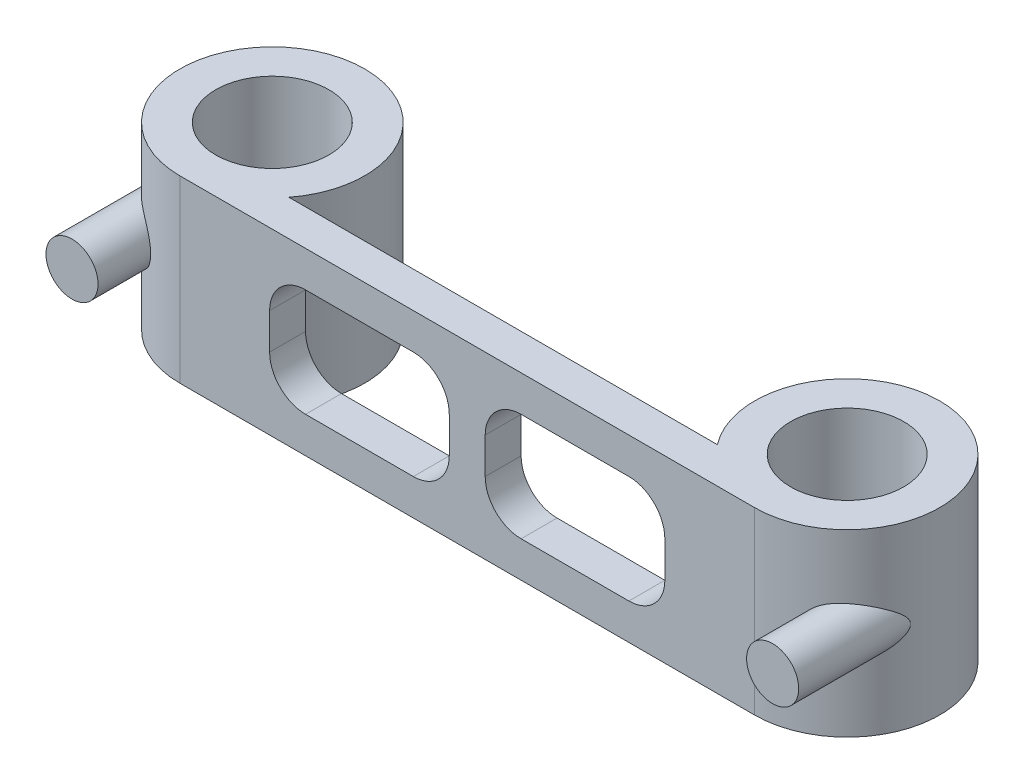
from build123d import *

# Parameters (mm, degrees)
SKETCH1_R           = 3.15
BOSS_EXTRUDE1_DEPTH = 10
BOSS_EXTRUDE2_REACH = 27.562
SKETCH2_R           = 1.45
BOSS_EXTRUDE3_START = 2.5
SKETCH3_R           = 1.45
BOSS_EXTRUDE3_DEPTH = 2.5
CUT_EXTRUDE1_REACH  = 27.562
SKETCH4_W           = 10
SKETCH4_H           = 6
FILLET1_R           = 2


with BuildPart() as part:
    # Sketch1 → Boss-Extrude1 (new body)
    with BuildSketch(Plane(origin=(0, 0, 0), x_dir=(1, 0, 0), z_dir=(0, 1, 0))):
        with BuildLine():
            Line((11.925690243, -3.15), (-11.925690243, -3.15))
            ThreePointArc((-11.925690243, -3.15), (-18.269361144, 4.623040125), (-16, -5.15))
            Line((-16, -5.15), (16, -5.15))
            ThreePointArc((16, -5.15), (18.269361144, 4.623040125), (11.925690243, -3.15))
        make_face()
        with Locations((-16, 0)):
            Circle(SKETCH1_R, mode=Mode.SUBTRACT)
        with Locations((16, 0)):
            Circle(SKETCH1_R, mode=Mode.SUBTRACT)
    extrude(amount=BOSS_EXTRUDE1_DEPTH)

    # Sketch2 → Boss-Extrude2 (add, up to next)
    with BuildSketch(Plane.XY.offset(5.15), mode=Mode.PRIVATE) as boss_extrude2_sk1:
        with Locations((-19.5, 5)):
            Circle(SKETCH2_R)
    boss_extrude2_tool1 = extrude(boss_extrude2_sk1.sketch, amount=-BOSS_EXTRUDE2_REACH, mode=Mode.PRIVATE) - part.part
    # Sketch2 → Boss-Extrude2 (add, up to next)
    with BuildSketch(Plane.XY.offset(5.15), mode=Mode.PRIVATE) as boss_extrude2_sk2:
        with Locations((19.5, 5)):
            Circle(SKETCH2_R)
    boss_extrude2_tool2 = extrude(boss_extrude2_sk2.sketch, amount=-BOSS_EXTRUDE2_REACH, mode=Mode.PRIVATE) - part.part
    add(boss_extrude2_tool1.solids().sort_by_distance((-19.5, 5, 5.15))[0])
    add(boss_extrude2_tool2.solids().sort_by_distance((19.5, 5, 5.15))[0])

    # Sketch3 → Boss-Extrude3 (add)
    with BuildSketch(Plane.XY.offset(5.15).offset(BOSS_EXTRUDE3_START)):
        with Locations((-19.5, 5)):
            Circle(SKETCH3_R)
        with Locations((19.5, 5)):
            Circle(SKETCH3_R)
    extrude(amount=-BOSS_EXTRUDE3_DEPTH)

    # Sketch4 → Cut-Extrude1 (cut, up to next)
    with BuildSketch(Plane.XY.offset(5.15), mode=Mode.PRIVATE) as cut_extrude1_sk1:
        with Locations((6, 5)):
            Rectangle(SKETCH4_W, SKETCH4_H)
    cut_extrude1_tool1 = extrude(cut_extrude1_sk1.sketch, amount=-CUT_EXTRUDE1_REACH, mode=Mode.PRIVATE) & part.part
    # Sketch4 → Cut-Extrude1 (cut, up to next)
    with BuildSketch(Plane.XY.offset(5.15), mode=Mode.PRIVATE) as cut_extrude1_sk2:
        with Locations((-6, 5)):
            Rectangle(SKETCH4_W, SKETCH4_H)
    cut_extrude1_tool2 = extrude(cut_extrude1_sk2.sketch, amount=-CUT_EXTRUDE1_REACH, mode=Mode.PRIVATE) & part.part
    add(cut_extrude1_tool1.solids().sort_by_distance((6, 5, 5.15))[0], mode=Mode.SUBTRACT)
    add(cut_extrude1_tool2.solids().sort_by_distance((-6, 5, 5.15))[0], mode=Mode.SUBTRACT)

    # Fillet1
    fillet1_edges = [part.edges().sort_by_distance(p)[0] for p in [
        (11, 2, 4.15),
        (11, 8, 4.15),
        (-11, 8, 4.15),
        (-11, 2, 4.15),
        (1, 2, 4.15),
        (1, 8, 4.15),
        (-1, 2, 4.15),
        (-1, 8, 4.15),
    ]]
    fillet(fillet1_edges, radius=FILLET1_R)


solid = part.part
